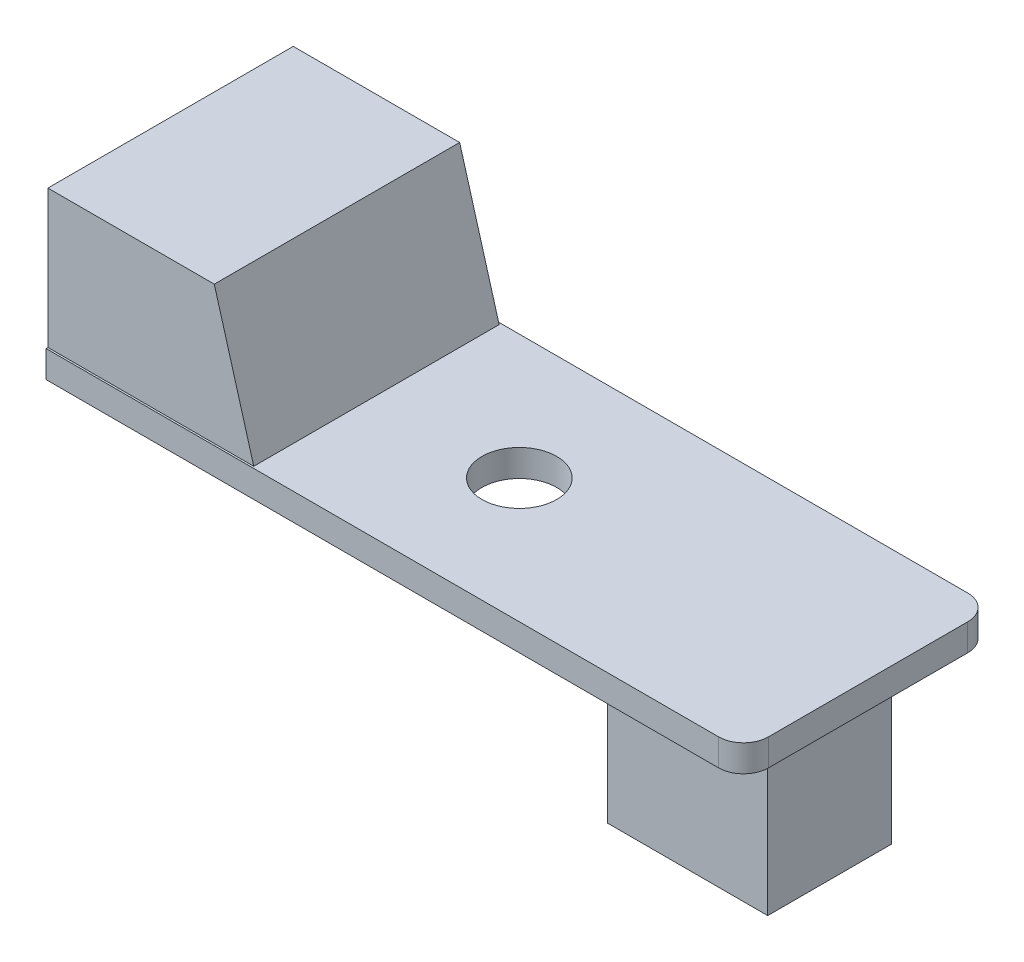
from build123d import *

# Parameters (mm, degrees)
SKETCH1_R           = 1.5
BOSS_EXTRUDE1_DEPTH = 1.08
SKETCH2_W           = 6.68
SKETCH2_H           = 9.85
BOSS_EXTRUDE2_DEPTH = 5.54
BOSS_EXTRUDE3_DEPTH = 9.85
SKETCH4_W           = 6.43
SKETCH4_H           = 4.96
BOSS_EXTRUDE4_DEPTH = 6.67


with BuildPart() as part:
    # Sketch1 → Boss-Extrude1 (new body)
    with BuildSketch(Plane(origin=(0, 0, 0), x_dir=(1, 0, 0), z_dir=(0, 1, 0))):
        with BuildLine():
            Line((0, 0), (27, 0))
            ThreePointArc((27, 0), (27.707106781, 0.292893219), (28, 1))
            Line((28, 1), (28, 9))
            ThreePointArc((28, 9), (27.707106781, 9.707106781), (27, 10))
            Line((27, 10), (0, 10))
            Line((0, 10), (0, 0))
        make_face()
        with Locations(Location((14, 5, 0), (0, 0, 270))):
            Circle(SKETCH1_R, mode=Mode.SUBTRACT)
    extrude(amount=BOSS_EXTRUDE1_DEPTH)

    # Sketch2 → Boss-Extrude2 (add)
    with BuildSketch(Plane(origin=(0, 1.08, 0), x_dir=(1, 0, 0), z_dir=(0, 1, 0))):
        with Locations((3.34, 5)):
            Rectangle(SKETCH2_W, SKETCH2_H)
    extrude(amount=BOSS_EXTRUDE2_DEPTH)

    # Sketch3 → Boss-Extrude3 (add)
    with BuildSketch(Plane.XY.offset(-0.075)):
        Polygon((0, 1.08), (8.264602566, 1.08), (6.68, 6.62), (0, 6.62), align=None)
    extrude(amount=-BOSS_EXTRUDE3_DEPTH)

    # Sketch4 → Boss-Extrude4 (add)
    with BuildSketch(Plane.XZ):
        with Locations((23.235, -5)):
            Rectangle(SKETCH4_W, SKETCH4_H)
    extrude(amount=BOSS_EXTRUDE4_DEPTH)


solid = part.part
